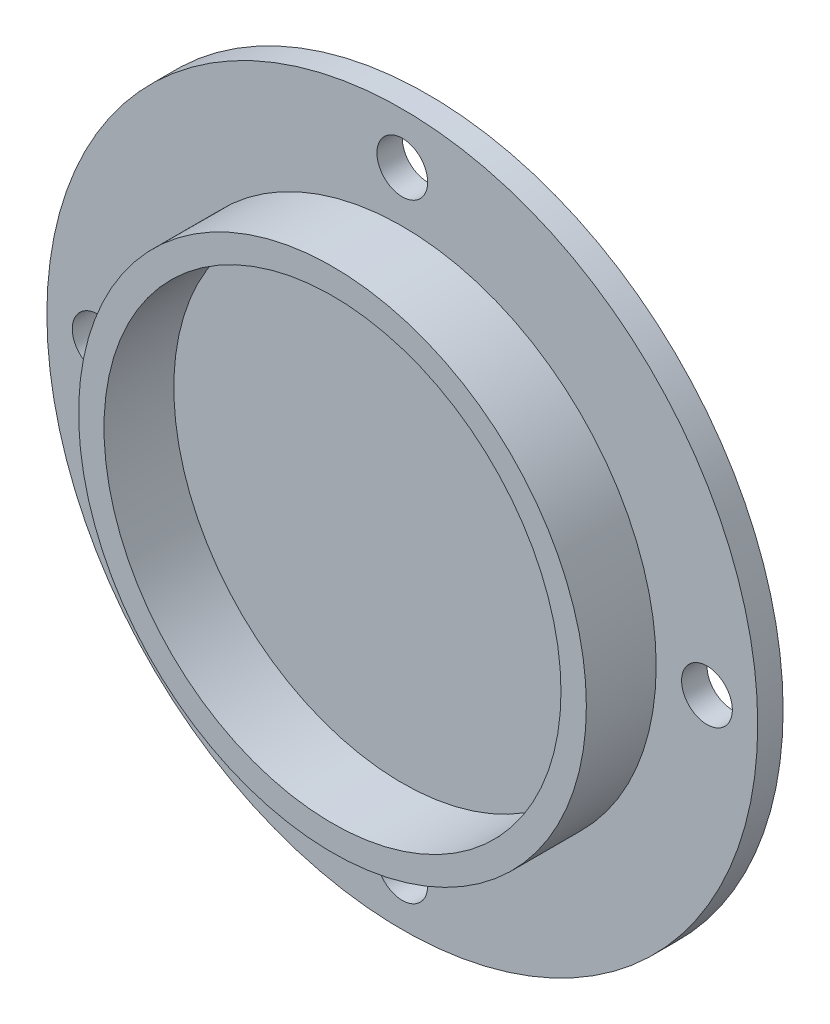
from build123d import *

# Parameters (mm, degrees)
SKETCH_1_R      = 140
SKETCH_1_R_2    = 10
EXTRUDE_1_DEPTH = 10
SKETCH_2_R      = 100
SKETCH_2_R_2    = 90
EXTRUDE_2_DEPTH = 27.5


with BuildPart() as part:
    # 草图1 → 拉伸1 (new body)
    with BuildSketch(Plane.XY):
        Circle(SKETCH_1_R)
        with Locations((0, 120)):
            Circle(SKETCH_1_R_2, mode=Mode.SUBTRACT)
        with Locations((-120, 0)):
            Circle(SKETCH_1_R_2, mode=Mode.SUBTRACT)
        with Locations((120, 0)):
            Circle(SKETCH_1_R_2, mode=Mode.SUBTRACT)
        with Locations((0, -120)):
            Circle(SKETCH_1_R_2, mode=Mode.SUBTRACT)
    extrude(amount=EXTRUDE_1_DEPTH)

    # 草图2 → 拉伸2 (add)
    with BuildSketch(Plane.XY.offset(10)):
        Circle(SKETCH_2_R)
        Circle(SKETCH_2_R_2, mode=Mode.SUBTRACT)
    extrude(amount=EXTRUDE_2_DEPTH)


solid = part.part
